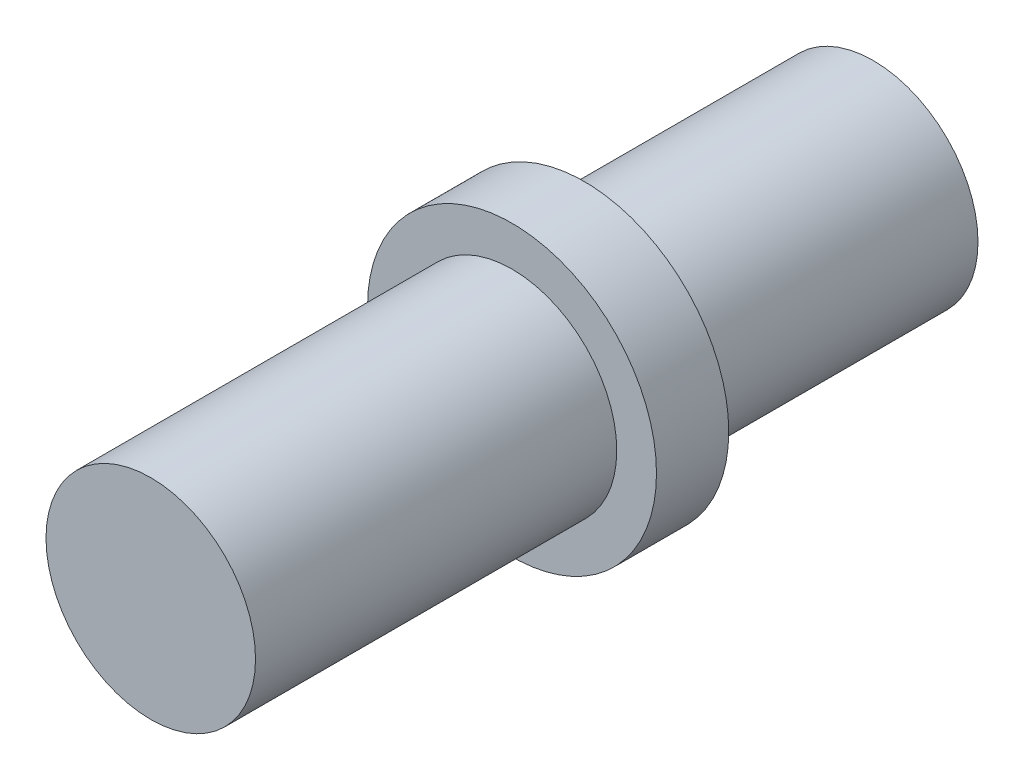
from build123d import *

# Parameters (mm, degrees)
SKETCH2_R              = 2.9
LOCATOR_SHAFT_DEPTH    = 20
LOCATOR_SHOULDER_START = 8
SKETCH3_R              = 4
LOCATOR_SHOULDER_DEPTH = 2


with BuildPart() as part:
    # Sketch2 → Locator_shaft (new body)
    with BuildSketch(Plane.XY):
        Circle(SKETCH2_R)
    extrude(amount=LOCATOR_SHAFT_DEPTH)

    # Sketch3 → Locator_shoulder (add)
    with BuildSketch(Plane.XY.offset(LOCATOR_SHOULDER_START)):
        Circle(SKETCH3_R)
    extrude(amount=LOCATOR_SHOULDER_DEPTH)


solid = part.part
